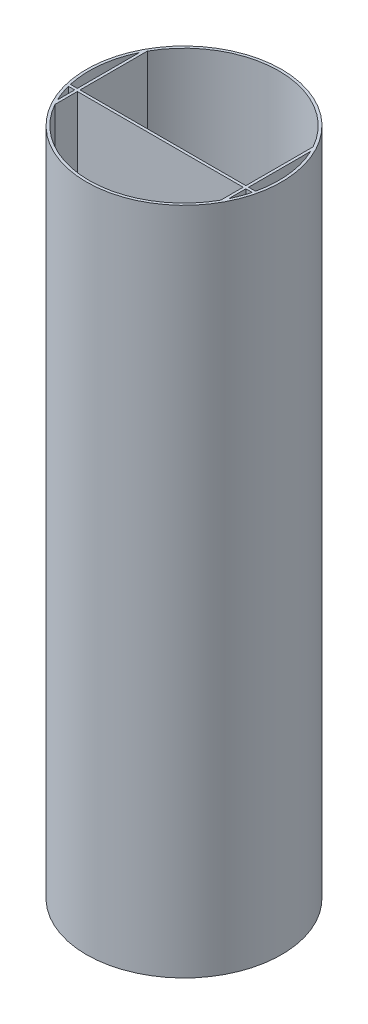
from build123d import *
from build123d.topology import SkipClean

# Parameters (mm, degrees)
BOSS_EXTRUDE1_DEPTH = 500
BOSS_EXTRUDE2_START = 2
SKETCH3_R           = 73.2
SKETCH3_R_2         = 2
BOSS_EXTRUDE2_DEPTH = 2
SKETCH4_R           = 2
BOSS_EXTRUDE3_DEPTH = 2


with BuildPart() as part:
    # Sketch1 → Boss-Extrude1 (new body)
    with BuildSketch(Plane(origin=(0, 0, 0), x_dir=(1, 0, 0), z_dir=(0, 1, 0))):
        with BuildLine():
            ThreePointArc((-62.2, -38.592745432), (20.064894717, -70.396306721), (73.2, 0))
            ThreePointArc((73.2, 0), (-18.149380155, 70.914314493), (-64.2, -35.165323829))
            ThreePointArc((-64.2, -35.165323829), (-63.223229945, -36.892589978), (-62.2, -38.592745432))
        make_face()
        with BuildLine():
            ThreePointArc((-64.2, -30.786360616), (-66.88547387, -24.408469537), (-68.939103562, -17.8))
            Line((-68.939103562, -17.8), (-64.2, -17.8))
            Line((-64.2, -17.8), (-64.2, -30.786360616))
        make_face(mode=Mode.SUBTRACT)
        with BuildLine():
            Line((-62.2, -17.8), (62.2, -17.8))
            Line((62.2, -17.8), (62.2, -34.649675323))
            ThreePointArc((62.2, -34.649675323), (0, -71.2), (-62.2, -34.649675323))
            Line((-62.2, -34.649675323), (-62.2, -17.8))
        make_face(mode=Mode.SUBTRACT)
        with BuildLine():
            Line((64.2, -30.786360616), (64.2, -17.8))
            Line((64.2, -17.8), (68.939103562, -17.8))
            ThreePointArc((68.939103562, -17.8), (66.88547387, -24.408469537), (64.2, -30.786360616))
        make_face(mode=Mode.SUBTRACT)
        with BuildLine():
            Line((-64.2, -15.8), (-69.424779438, -15.8))
            ThreePointArc((-69.424779438, -15.8), (-70.756396664, 7.93551077), (-64.2, 30.786360616))
            Line((-64.2, 30.786360616), (-64.2, -15.8))
        make_face(mode=Mode.SUBTRACT)
        with BuildLine():
            ThreePointArc((-62.2, 34.649675323), (0, 71.2), (62.2, 34.649675323))
            Line((62.2, 34.649675323), (62.2, -15.8))
            Line((62.2, -15.8), (-62.2, -15.8))
            Line((-62.2, -15.8), (-62.2, 34.649675323))
        make_face(mode=Mode.SUBTRACT)
        with BuildLine():
            Line((64.2, -15.8), (64.2, 30.786360616))
            ThreePointArc((64.2, 30.786360616), (70.756396664, 7.93551077), (69.424779438, -15.8))
            Line((69.424779438, -15.8), (64.2, -15.8))
        make_face(mode=Mode.SUBTRACT)
    extrude(amount=BOSS_EXTRUDE1_DEPTH)

    # Sketch3 → Boss-Extrude2 (add)
    with SkipClean():  # the faces are left unmerged after this step: merging them gives an invalid solid
        with BuildSketch(Plane.XZ.offset(BOSS_EXTRUDE2_START)):
            with Locations(Location((0, 0, 0), (0, 0, 270))):
                Circle(SKETCH3_R)
            with Locations(Location((0, -27.7, 0), (0, 0, 270))):
                Circle(SKETCH3_R_2, mode=Mode.SUBTRACT)
            with Locations(Location((0, 41.5, 0), (0, 0, 270))):
                Circle(SKETCH3_R_2, mode=Mode.SUBTRACT)
        extrude(amount=-BOSS_EXTRUDE2_DEPTH)

    # Sketch4 → Boss-Extrude3 (add)
    # profile 1 of 2: a face of its own
    with SkipClean():  # the faces are left unmerged after this step: merging them gives an invalid solid
        with BuildSketch(Plane(origin=(0, 40, 0), x_dir=(1, 0, 0), z_dir=(0, 1, 0))):
            with BuildLine():
                Line((-62.2, -17.8), (-62.2, -34.649675323))
                ThreePointArc((-62.2, -34.649675323), (0, -71.2), (62.2, -34.649675323))
                Line((62.2, -34.649675323), (62.2, -17.8))
                Line((62.2, -17.8), (-62.2, -17.8))
            make_face()
            with Locations(Location((0, -41.5, 0), (0, 0, 90))):
                Circle(SKETCH4_R, mode=Mode.SUBTRACT)
        # profile 2 of 2: a face of its own
        with BuildSketch(Plane(origin=(0, 40, 0), x_dir=(1, 0, 0), z_dir=(0, 1, 0))):
            with BuildLine():
                Line((62.2, -15.8), (62.2, 34.649675323))
                ThreePointArc((62.2, 34.649675323), (0, 71.2), (-62.2, 34.649675323))
                Line((-62.2, 34.649675323), (-62.2, -15.8))
                Line((-62.2, -15.8), (62.2, -15.8))
            make_face()
            with Locations(Location((0, 27.7, 0), (0, 0, 90))):
                Circle(SKETCH4_R, mode=Mode.SUBTRACT)
        extrude(amount=BOSS_EXTRUDE3_DEPTH)


solid = part.part
